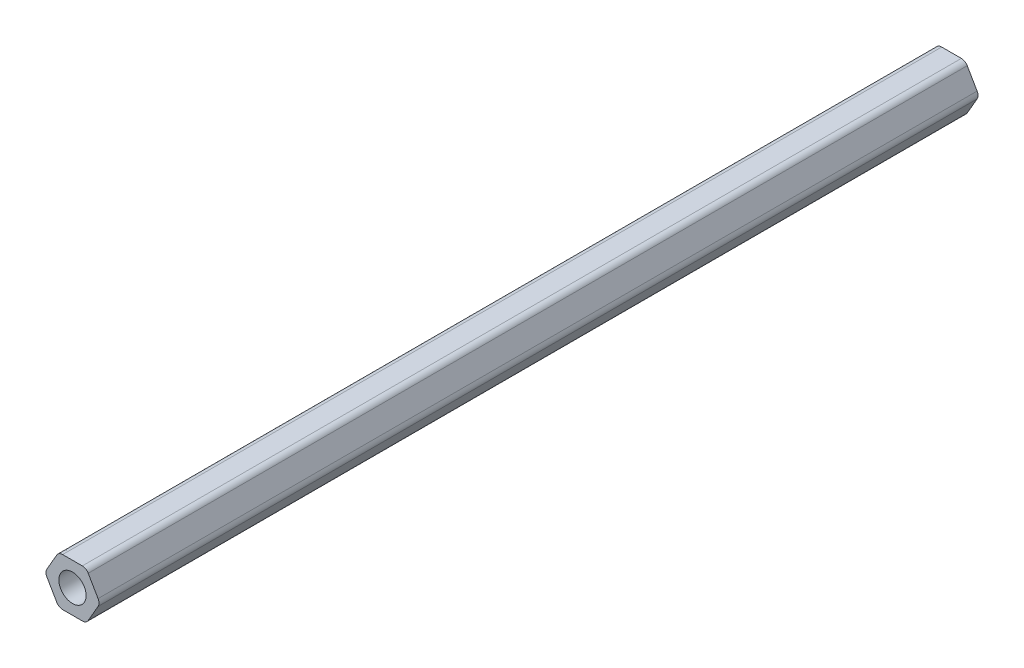
from build123d import *

# Parameters (mm, degrees)
EXTRUDE_1_DEPTH     = 129
SKETCH_2_R          = 2
CUT_EXTRUDE_1_DEPTH = 6
CUT_EXTRUDE_START   = -6
SKETCH_3_R          = 2
CUT_EXTRUDE_2_DEPTH = 6


with BuildPart() as part:
    # Эскиз1 → Бобышка-Вытянуть1 (new body)
    with BuildSketch(Plane.XY):
        with BuildLine():
            Line((3.75277675, 0.5), (2.309401077, 3))
            ThreePointArc((2.309401077, 3), (1.943375673, 3.366025404), (1.443375673, 3.5))
            Line((1.443375673, 3.5), (-1.443375673, 3.5))
            ThreePointArc((-1.443375673, 3.5), (-1.943375673, 3.366025404), (-2.309401077, 3))
            Line((-2.309401077, 3), (-3.75277675, 0.5))
            ThreePointArc((-3.75277675, 0.5), (-3.886751346, 0), (-3.75277675, -0.5))
            Line((-3.75277675, -0.5), (-2.309401077, -3))
            ThreePointArc((-2.309401077, -3), (-1.943375673, -3.366025404), (-1.443375673, -3.5))
            Line((-1.443375673, -3.5), (1.443375673, -3.5))
            ThreePointArc((1.443375673, -3.5), (1.943375673, -3.366025404), (2.309401077, -3))
            Line((2.309401077, -3), (3.75277675, -0.5))
            ThreePointArc((3.75277675, -0.5), (3.886751346, 0), (3.75277675, 0.5))
        make_face()
    extrude(amount=EXTRUDE_1_DEPTH)

    # Эскиз2 → Вырез-Вытянуть1 (cut)
    with BuildSketch(Plane.XY.offset(129)):
        Circle(SKETCH_2_R)
    extrude(amount=-CUT_EXTRUDE_1_DEPTH, mode=Mode.SUBTRACT)

    # Эскиз3 → Вырез-Вытянуть2 (cut)
    with BuildSketch(Plane(origin=(0, 0, 0), x_dir=(-1, 0, 0), z_dir=(0, 0, -1)).offset(CUT_EXTRUDE_START)):
        with Locations(Location((0, 0, 0), (0, 0, 180))):
            Circle(SKETCH_3_R)
    extrude(amount=CUT_EXTRUDE_2_DEPTH, mode=Mode.SUBTRACT)


solid = part.part
